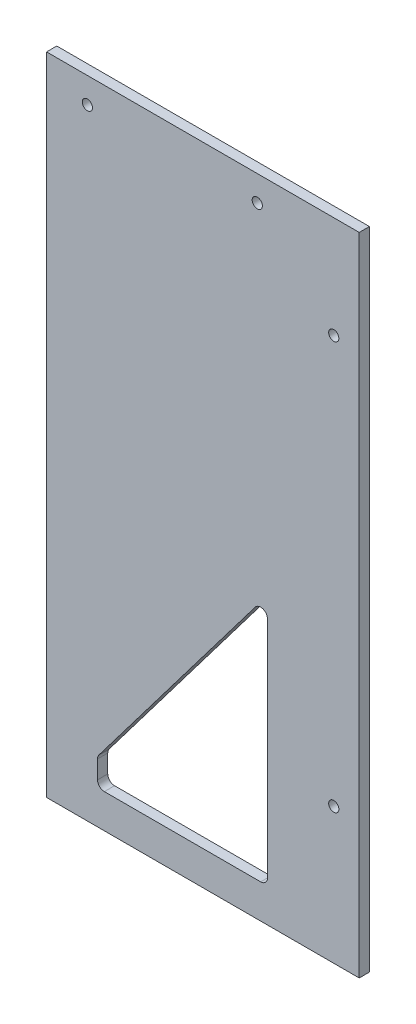
from build123d import *

# Parameters (mm, degrees)
SKETCH_1_W          = 92
SKETCH_1_H          = 190
EXTRUDE_1_DEPTH     = 3
SKETCH_2_R          = 1.5
CUT_EXTRUDE_1_DEPTH = 106.59356041
CUT_EXTRUDE_2_DEPTH = 106.59356041
FILLET_2_R          = 2


with BuildPart() as part:
    # 草图1 → 凸台-拉伸1 (new body)
    with BuildSketch(Plane.XY):
        Rectangle(SKETCH_1_W, SKETCH_1_H)
    extrude(amount=EXTRUDE_1_DEPTH)

    # 草图2 → 切除-拉伸1 (cut, through all)
    with BuildSketch(Plane.XY.offset(3)):
        with Locations((-34, 87.5)):
            Circle(SKETCH_2_R)
        with Locations((16, 87.5)):
            Circle(SKETCH_2_R)
        with Locations((38.5, 65)):
            Circle(SKETCH_2_R)
        with Locations((38.5, -55)):
            Circle(SKETCH_2_R)
    extrude(amount=-CUT_EXTRUDE_1_DEPTH, mode=Mode.SUBTRACT)

    # 草图3 → 切除-拉伸2 (cut, through all)
    with BuildSketch(Plane.XY.offset(3)):
        Polygon((19, -15), (16, -15), (-31, -77), (-31, -85), (19, -85), align=None)
    extrude(amount=-CUT_EXTRUDE_2_DEPTH, mode=Mode.SUBTRACT)

    # 圆角2
    fillet_2_edges = [part.edges().sort_by_distance(p)[0] for p in [
        (-31, -77, 1.5),
        (16, -15, 1.5),
        (19, -15, 1.5),
        (19, -85, 1.5),
        (-31, -85, 1.5),
    ]]
    fillet(fillet_2_edges, radius=FILLET_2_R)


solid = part.part
